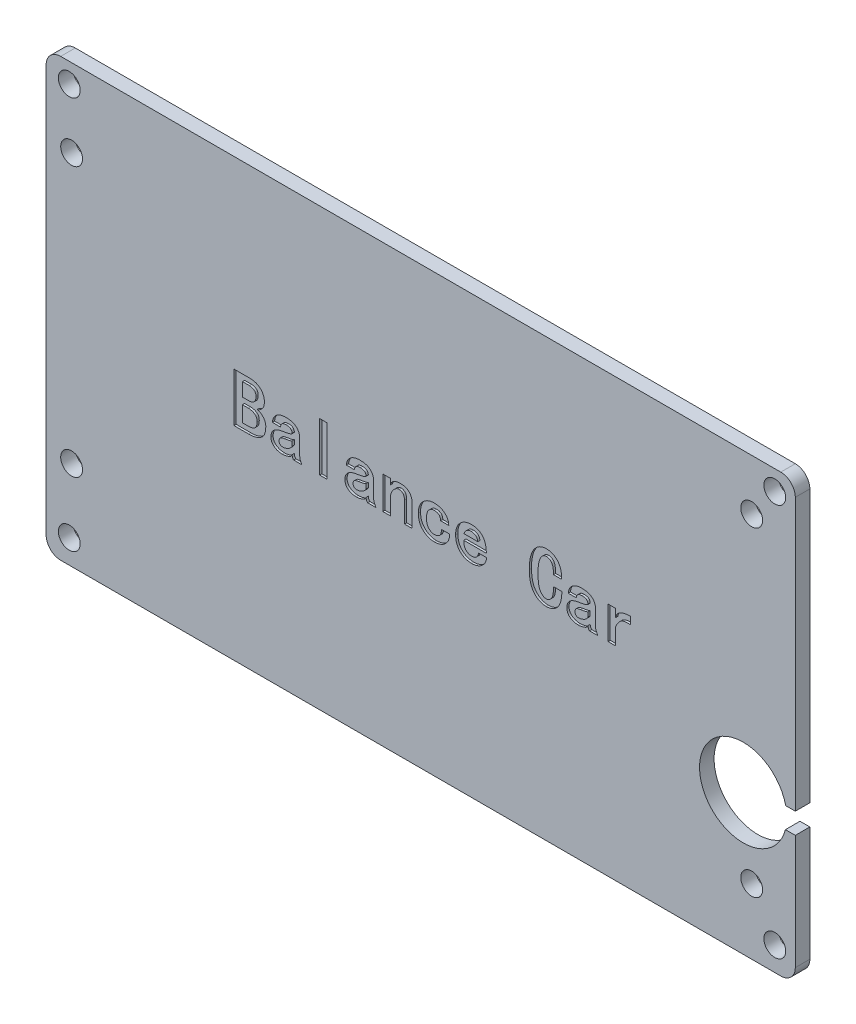
from build123d import *

# Parameters (mm, degrees)
SKETCH_1_R          = 1.5
EXTRUDE_1_DEPTH     = 2
SKETCH_2_W          = 1.042999115
SKETCH_2_H          = 6.730377939
CUT_EXTRUDE_1_DEPTH = 0.3


with BuildPart() as part:
    # 草图1 → 凸台-拉伸1 (new body)
    with BuildSketch(Plane.XY):
        with BuildLine():
            Line((26.817070392, -30.978962474), (26.817070392, -46.730080149))
            ThreePointArc((26.817070392, -46.730080149), (26.231283954, -48.144293711), (24.817070392, -48.730080149))
            Line((24.817070392, -48.730080149), (-74.182929608, -48.730080149))
            ThreePointArc((-74.182929608, -48.730080149), (-75.59714317, -48.144293711), (-76.182929608, -46.730080149))
            Line((-76.182929608, -46.730080149), (-76.182929608, 9.269919851))
            ThreePointArc((-76.182929608, 9.269919851), (-75.59714317, 10.684133414), (-74.182929608, 11.269919851))
            Line((-74.182929608, 11.269919851), (24.817070392, 11.269919851))
            ThreePointArc((24.817070392, 11.269919851), (26.231283954, 10.684133414), (26.817070392, 9.269919851))
            Line((26.817070392, 9.269919851), (26.817070392, -28.10613796))
            Line((26.817070392, -28.10613796), (25.497876265, -28.10613796))
            ThreePointArc((25.497876265, -28.10613796), (13.653701765, -29.379481549), (25.458257421, -30.978962474))
            Line((25.458257421, -30.978962474), (26.817070392, -30.978962474))
        make_face()
        with Locations((-73.004739745, 8.560498058)):
            Circle(SKETCH_1_R, mode=Mode.SUBTRACT)
        with Locations((23.995260255, 8.560498058)):
            Circle(SKETCH_1_R, mode=Mode.SUBTRACT)
        with Locations((20.817070392, 4.269919851)):
            Circle(SKETCH_1_R, mode=Mode.SUBTRACT)
        with Locations((-72.682929608, 0.547627493)):
            Circle(SKETCH_1_R, mode=Mode.SUBTRACT)
        with Locations((-73.004739745, -45.439501942)):
            Circle(SKETCH_1_R, mode=Mode.SUBTRACT)
        with Locations((-72.682929608, -36.452372507)):
            Circle(SKETCH_1_R, mode=Mode.SUBTRACT)
        with Locations((23.995260255, -45.439501942)):
            Circle(SKETCH_1_R, mode=Mode.SUBTRACT)
        with Locations((20.817070392, -39.730080149)):
            Circle(SKETCH_1_R, mode=Mode.SUBTRACT)
    extrude(amount=EXTRUDE_1_DEPTH)

    # 草图2 → 切除-拉伸1 (cut)
    # profile 1 of 10: a face of its own
    with BuildSketch(Plane.XY.offset(2)):
        with BuildLine():
            add(Edge.make_bspline(
                [(-45.985135768, -18.734413433), (-45.986803011, -18.825043737), (-45.990024548, -19.000164548), (-46.022328184, -19.252162776), (-46.073830874, -19.483628418), (-46.145240111, -19.69479899), (-46.239624747, -19.884323675), (-46.354934414, -20.052492992), (-46.490547453, -20.200648991), (-46.647923039, -20.325821392), (-46.821047256, -20.431966568), (-47.005499215, -20.524413636), (-47.200614613, -20.604794987), (-47.408572708, -20.667138425), (-47.627314907, -20.719020233), (-47.858495469, -20.751771594), (-48.101005177, -20.774827928), (-48.266577138, -20.777268331), (-48.351385836, -20.778518345)],
                knots=[0, 0, 0, 0, 1.214216004, 2.346174309, 3.398354795, 4.388279313, 5.326350126, 6.226833345, 7.112954168, 8.008031957, 8.912461697, 9.830332446, 10.771174523, 11.736815783, 12.73722573, 13.781438273, 14.863615984, 16, 16, 16, 16], degree=3))
            Line((-48.351385836, -20.778518345), (-50.357931223, -20.778518345))
            Line((-50.357931223, -20.778518345), (-50.357931223, -14.048140406))
            Line((-50.357931223, -14.048140406), (-48.274822189, -14.048140406))
            add(Edge.make_bspline(
                [(-48.274822189, -14.048140406), (-48.189066218, -14.049898241), (-48.022962927, -14.053303045), (-47.782022008, -14.076781247), (-47.558849711, -14.121487965), (-47.35072031, -14.177188451), (-47.160877903, -14.254775413), (-46.987113777, -14.346959927), (-46.830941346, -14.457871842), (-46.693200204, -14.584967527), (-46.572725138, -14.722511592), (-46.466118874, -14.864516212), (-46.37606078, -15.011832411), (-46.303696086, -15.165254492), (-46.245162957, -15.322475818), (-46.204464797, -15.485719642), (-46.181490121, -15.653874178), (-46.177722677, -15.767625144), (-46.175822587, -15.824994852)],
                knots=[0, 0, 0, 0, 1.33113717, 2.578319164, 3.750959862, 4.860775065, 5.916972853, 6.926855544, 7.90778062, 8.88113087, 9.828922234, 10.742256505, 11.634396839, 12.503607127, 13.37140239, 14.234259165, 15.109457783, 16, 16, 16, 16], degree=3))
            add(Edge.make_bspline(
                [(-46.175822587, -15.824994852), (-46.176991183, -15.881373114), (-46.179263294, -15.990989843), (-46.195125336, -16.150401212), (-46.221588754, -16.299082172), (-46.261831192, -16.436423274), (-46.309296702, -16.563757837), (-46.371416989, -16.678803847), (-46.441996323, -16.784337559), (-46.549659578, -16.904446269), (-46.688602589, -17.029386027), (-46.853331069, -17.148780115), (-47.012274899, -17.232268379), (-47.120381871, -17.256682329), (-47.171149996, -17.268147366)],
                knots=[0, 0, 0, 0, 1.066354622, 2.073322247, 3.027359755, 3.918209834, 4.777534225, 5.592506442, 6.385810961, 7.17328942, 8.6370913, 9.910926524, 11.018950027, 12, 12, 12, 12], degree=3))
            add(Edge.make_bspline(
                [(-47.171149996, -17.268147366), (-47.10390849, -17.281959962), (-46.964896089, -17.310515571), (-46.763382797, -17.406475449), (-46.564535826, -17.543294002), (-46.406242733, -17.687133627), (-46.283487497, -17.817590845), (-46.205010737, -17.928439742), (-46.135303836, -18.044483702), (-46.081544383, -18.169326697), (-46.037089594, -18.299988058), (-46.007517039, -18.438665562), (-45.98792576, -18.584092611), (-45.986075432, -18.683785651), (-45.985135768, -18.734413433)],
                knots=[0, 0, 0, 0, 1.203910315, 2.488916061, 3.891524143, 5.439134463, 6.242555454, 7.037221142, 7.823170937, 8.619595385, 9.423194974, 10.247336316, 11.109933089, 12, 12, 12, 12], degree=3))
        make_face()
        with BuildLine():
            add(Edge.make_bspline(
                [(-47.33438947, -15.824994852), (-47.335286994, -15.788368864), (-47.337015919, -15.717815243), (-47.348383372, -15.615721236), (-47.368373382, -15.521220794), (-47.397304958, -15.434642871), (-47.433364792, -15.355156757), (-47.478806726, -15.284349056), (-47.530482586, -15.219545151), (-47.613039841, -15.147057976), (-47.727579641, -15.07040969), (-47.883781783, -15.006249414), (-48.05518492, -14.966526395), (-48.175402382, -14.96200682), (-48.237262664, -14.959681183)],
                knots=[0, 0, 0, 0, 0.927142937, 1.785980239, 2.596484439, 3.367432301, 4.092799605, 4.799595254, 5.492591191, 6.183009329, 7.572534581, 8.960294269, 10.435859072, 12, 12, 12, 12], degree=3))
            Line((-48.237262664, -14.959681183), (-49.200808937, -14.959681183))
            Line((-49.200808937, -14.959681183), (-49.200808937, -16.804431693))
            Line((-49.200808937, -16.804431693), (-48.274822189, -16.804431693))
            add(Edge.make_bspline(
                [(-48.274822189, -16.804431693), (-48.21245414, -16.801704139), (-48.090577703, -16.796374091), (-47.915079775, -16.753243311), (-47.753201525, -16.683421245), (-47.632001157, -16.600945914), (-47.544622873, -16.521153919), (-47.487974613, -16.449298283), (-47.440440032, -16.367899184), (-47.401415436, -16.277630618), (-47.370740919, -16.177886115), (-47.349891002, -16.068402212), (-47.336642409, -15.949554228), (-47.335156592, -15.867407145), (-47.33438947, -15.824994852)],
                knots=[0, 0, 0, 0, 1.451379929, 2.836212108, 4.182481497, 5.538993073, 6.229475639, 6.931972211, 7.661100203, 8.419662085, 9.217987839, 10.086952726, 11.012299424, 12, 12, 12, 12], degree=3))
        make_face(mode=Mode.SUBTRACT)
        with BuildLine():
            add(Edge.make_bspline(
                [(-47.181262176, -18.734413433), (-47.182320078, -18.689575769), (-47.184376077, -18.602435184), (-47.201627928, -18.476947839), (-47.230458719, -18.361554248), (-47.270444692, -18.256740645), (-47.323680086, -18.162829563), (-47.38690171, -18.078365926), (-47.463340959, -18.005126301), (-47.580208899, -17.923574465), (-47.739508623, -17.83929851), (-47.945486894, -17.769143092), (-48.163523583, -17.723538539), (-48.31359096, -17.718533742), (-48.390389958, -17.71597247)],
                knots=[0, 0, 0, 0, 0.89950437, 1.748158365, 2.535631478, 3.282137647, 3.991705508, 4.695193889, 5.392281939, 6.105590437, 7.549383668, 8.991818094, 10.460522455, 12, 12, 12, 12], degree=3))
            Line((-48.390389958, -17.71597247), (-49.200808937, -17.71597247))
            Line((-49.200808937, -17.71597247), (-49.200808937, -19.866977568))
            Line((-49.200808937, -19.866977568), (-48.50451313, -19.866977568))
            add(Edge.make_bspline(
                [(-48.50451313, -19.866977568), (-48.451040077, -19.866108264), (-48.347816611, -19.864430175), (-48.197837714, -19.852618269), (-48.058385593, -19.834277866), (-47.928722602, -19.808815908), (-47.809994391, -19.773929932), (-47.701119263, -19.732192517), (-47.60190371, -19.683204505), (-47.512580489, -19.625175054), (-47.433514816, -19.556463416), (-47.364295169, -19.47630615), (-47.308364404, -19.381721815), (-47.260242184, -19.276455969), (-47.224748, -19.157744454), (-47.198682102, -19.027699024), (-47.18505884, -18.884935998), (-47.182562403, -18.785962237), (-47.181262176, -18.734413433)],
                knots=[0, 0, 0, 0, 1.269965571, 2.451519813, 3.57082322, 4.609321398, 5.586495255, 6.506157291, 7.375666785, 8.209937576, 9.028698946, 9.856121335, 10.713282766, 11.629524913, 12.599038758, 13.648749371, 14.775391023, 16, 16, 16, 16], degree=3))
        make_face(mode=Mode.SUBTRACT)
    # profile 2 of 10: a face of its own
    with BuildSketch(Plane.XY.offset(2)):
        with BuildLine():
            Line((-41.014277109, -20.778518345), (-42.158398021, -20.778518345))
            add(Edge.make_bspline(
                [(-42.158398021, -20.778518345), (-42.194184962, -20.737819291), (-42.264220465, -20.658170717), (-42.323646686, -20.513435035), (-42.354240787, -20.374412659), (-42.360604058, -20.284107973), (-42.363530811, -20.242572817)],
                knots=[0, 0, 0, 0, 1.100022695, 2.152758582, 3.150371228, 4, 4, 4, 4], degree=3))
            add(Edge.make_bspline(
                [(-42.363530811, -20.242572817), (-42.367619879, -20.26443148), (-42.375925903, -20.308832449), (-42.40228947, -20.372932443), (-42.44259536, -20.433167615), (-42.495467346, -20.489322513), (-42.5598347, -20.543305047), (-42.637159455, -20.593668203), (-42.726889492, -20.640843598), (-42.861692789, -20.699990857), (-43.041304621, -20.761914403), (-43.264925353, -20.814834616), (-43.493531362, -20.850108527), (-43.648128885, -20.853419056), (-43.725785887, -20.855081992)],
                knots=[0, 0, 0, 0, 0.502173328, 1.020052439, 1.554841723, 2.133027758, 2.759295304, 3.451193378, 4.216313692, 5.050302141, 6.779755723, 8.50512169, 10.244462344, 12, 12, 12, 12], degree=3))
            add(Edge.make_bspline(
                [(-43.725785887, -20.855081992), (-43.778297357, -20.853735711), (-43.881587982, -20.851087563), (-44.033850083, -20.837224245), (-44.180079794, -20.810833718), (-44.320640788, -20.77477687), (-44.45515428, -20.728869249), (-44.583352528, -20.671615602), (-44.706006111, -20.605692528), (-44.821551339, -20.529432082), (-44.927570174, -20.443206233), (-45.0196658, -20.34622735), (-45.099930276, -20.241018272), (-45.162523738, -20.125030615), (-45.212891961, -20.000669446), (-45.246450285, -19.866918219), (-45.269205424, -19.72473526), (-45.271681189, -19.626787186), (-45.272949392, -19.576613549)],
                knots=[0, 0, 0, 0, 1.116649071, 2.19646067, 3.246750187, 4.27224868, 5.279130669, 6.264549121, 7.25400097, 8.236436849, 9.20382194, 10.152389194, 11.073772815, 12.008482691, 12.945712081, 13.919091576, 14.934060268, 16, 16, 16, 16], degree=3))
            add(Edge.make_bspline(
                [(-45.272949392, -19.576613549), (-45.272186765, -19.526448252), (-45.270698749, -19.428567166), (-45.248968172, -19.286066003), (-45.217894354, -19.150848775), (-45.173268378, -19.023175052), (-45.114493981, -18.904115777), (-45.045172759, -18.791279797), (-44.960869178, -18.687763381), (-44.864523766, -18.591460958), (-44.755235592, -18.502725748), (-44.632530332, -18.422443076), (-44.496623949, -18.349677676), (-44.348241227, -18.285194112), (-44.186369649, -18.228703588), (-44.011568661, -18.180258243), (-43.823690524, -18.137686834), (-43.693190519, -18.117721307), (-43.626108686, -18.107458287)],
                knots=[0, 0, 0, 0, 0.983259561, 1.918507781, 2.821368131, 3.702819264, 4.564764925, 5.421986139, 6.29545235, 7.177257814, 8.090585748, 9.052230552, 10.049773976, 11.111675609, 12.223185354, 13.41059661, 14.668950802, 16, 16, 16, 16], degree=3))
            add(Edge.make_bspline(
                [(-43.626108686, -18.107458287), (-43.540315295, -18.094457502), (-43.375609097, -18.069498587), (-43.140088976, -18.025950423), (-42.92578067, -17.98075615), (-42.762582533, -17.937372519), (-42.645297363, -17.903038726), (-42.571437187, -17.874952302), (-42.508166217, -17.848612769), (-42.456326309, -17.820728615), (-42.415558955, -17.79294246), (-42.386759483, -17.762954712), (-42.367395347, -17.732440872), (-42.364764931, -17.710415578), (-42.363530811, -17.700081902)],
                knots=[0, 0, 0, 0, 2.284980094, 4.386705999, 6.306867416, 8.050866871, 8.833092395, 9.523248254, 10.131012504, 10.63602979, 11.072375292, 11.422197182, 11.728910465, 12, 12, 12, 12], degree=3))
            add(Edge.make_bspline(
                [(-42.363530811, -17.700081902), (-42.365058019, -17.667126203), (-42.368192435, -17.599488474), (-42.399451608, -17.49967558), (-42.446721993, -17.39935173), (-42.500836718, -17.317696016), (-42.556231397, -17.253809308), (-42.613414931, -17.213154721), (-42.68117586, -17.178964681), (-42.760986625, -17.151549915), (-42.851578558, -17.130599778), (-42.953932687, -17.114849828), (-43.067802558, -17.104531212), (-43.147922602, -17.103830105), (-43.189840358, -17.103463295)],
                knots=[0, 0, 0, 0, 1.02146559, 2.096438976, 3.22098731, 4.461868767, 5.12921033, 5.83550898, 6.625174876, 7.481756993, 8.450804338, 9.511097336, 10.697838769, 12, 12, 12, 12], degree=3))
            add(Edge.make_bspline(
                [(-43.189840358, -17.103463295), (-43.247216103, -17.105054189), (-43.353911247, -17.108012592), (-43.502489912, -17.131052777), (-43.625539609, -17.173923854), (-43.728731409, -17.23516751), (-43.808924117, -17.326099957), (-43.880457251, -17.440787465), (-43.939720108, -17.587356128), (-43.969692109, -17.696350827), (-43.985813367, -17.754976592)],
                knots=[0, 0, 0, 0, 1.199713594, 2.230970886, 3.129074979, 3.911404785, 4.709324343, 5.636805749, 6.728891641, 8, 8, 8, 8], degree=3))
            Line((-43.985813367, -17.754976592), (-45.082262574, -17.754976592))
            add(Edge.make_bspline(
                [(-45.082262574, -17.754976592), (-45.073972562, -17.694165316), (-45.057743847, -17.575119779), (-45.019492474, -17.403016425), (-44.965558333, -17.242345267), (-44.897741728, -17.093993829), (-44.817592071, -16.956061395), (-44.723891013, -16.830197771), (-44.61539977, -16.716734489), (-44.495435581, -16.61402959), (-44.364080175, -16.52332925), (-44.222677606, -16.444766762), (-44.072099226, -16.378658038), (-43.912867247, -16.323280613), (-43.744428229, -16.281874994), (-43.567733116, -16.251819667), (-43.381931909, -16.232179284), (-43.254898631, -16.230395554), (-43.189840358, -16.229482043)],
                knots=[0, 0, 0, 0, 1.089185795, 2.132214889, 3.124226488, 4.091967635, 5.022881988, 5.95116336, 6.870189767, 7.803807937, 8.749864533, 9.698812801, 10.670847843, 11.665617538, 12.687666101, 13.745821166, 14.845554606, 16, 16, 16, 16], degree=3))
            add(Edge.make_bspline(
                [(-43.189840358, -16.229482043), (-43.114211544, -16.231094504), (-42.967051088, -16.234232072), (-42.753946583, -16.251894085), (-42.555567929, -16.285677887), (-42.372167556, -16.331073833), (-42.2025646, -16.390466258), (-42.048555299, -16.463627509), (-41.908655704, -16.549924111), (-41.784780831, -16.649299918), (-41.676172183, -16.760479821), (-41.579646615, -16.878446209), (-41.500410973, -17.00741627), (-41.432469515, -17.14355385), (-41.382901778, -17.290113085), (-41.346371131, -17.444837548), (-41.324551874, -17.607968122), (-41.321887501, -17.719759123), (-41.320531697, -17.776645549)],
                knots=[0, 0, 0, 0, 1.318220954, 2.565027611, 3.722553634, 4.82165684, 5.854152741, 6.848885895, 7.787371559, 8.712669592, 9.608735395, 10.492096577, 11.36297217, 12.241216083, 13.13826379, 14.052227777, 15.008848671, 16, 16, 16, 16], degree=3))
            Line((-41.320531697, -17.776645549), (-41.320531697, -19.882868137))
            add(Edge.make_bspline(
                [(-41.320531697, -19.882868137), (-41.319849361, -19.920478842), (-41.318505617, -19.994546775), (-41.303522722, -20.102339186), (-41.280636911, -20.204443179), (-41.247527507, -20.302887532), (-41.203053325, -20.404298757), (-41.149286811, -20.516637974), (-41.086069757, -20.643493298), (-41.039052227, -20.731922189), (-41.014277109, -20.778518345)],
                knots=[0, 0, 0, 0, 0.941403301, 1.853934819, 2.719932207, 3.558972484, 4.450542, 5.491721692, 6.67830383, 8, 8, 8, 8], degree=3))
        make_face()
        with BuildLine():
            Line((-42.363530811, -19.247245408), (-42.363530811, -18.597176708))
            add(Edge.make_bspline(
                [(-42.363530811, -18.597176708), (-42.374684716, -18.607844799), (-42.401330925, -18.633330418), (-42.461776174, -18.662103718), (-42.542909475, -18.692867852), (-42.649981547, -18.725403266), (-42.786378546, -18.756089616), (-42.956818427, -18.791111388), (-43.163461006, -18.828153951), (-43.314023915, -18.851744082), (-43.394973148, -18.864427173)],
                knots=[0, 0, 0, 0, 0.342881926, 0.819130423, 1.476051372, 2.285518165, 3.313039493, 4.597202055, 6.17050637, 8, 8, 8, 8], degree=3))
            add(Edge.make_bspline(
                [(-43.394973148, -18.864427173), (-43.43305484, -18.8699269), (-43.50609295, -18.880475004), (-43.610505703, -18.900070633), (-43.703723678, -18.925036189), (-43.787020391, -18.950546285), (-43.859553131, -18.97939458), (-43.921970419, -19.010533279), (-43.973594835, -19.045449116), (-44.02752141, -19.095519391), (-44.078821113, -19.168382895), (-44.122937557, -19.26744676), (-44.148842573, -19.379808493), (-44.151834697, -19.458983788), (-44.153386631, -19.500049902)],
                knots=[0, 0, 0, 0, 1.241544523, 2.381198435, 3.425107394, 4.353856387, 5.190577729, 5.941057891, 6.600442346, 7.194130352, 8.306773393, 9.447380148, 10.676024142, 12, 12, 12, 12], degree=3))
            add(Edge.make_bspline(
                [(-44.153386631, -19.500049902), (-44.151743158, -19.534873618), (-44.148571386, -19.6020806), (-44.123696059, -19.697402435), (-44.082738757, -19.781647523), (-44.025745089, -19.853996426), (-43.951822919, -19.911255742), (-43.862863177, -19.951845175), (-43.760310395, -19.976428736), (-43.687407187, -19.979494806), (-43.64922224, -19.98110074)],
                knots=[0, 0, 0, 0, 1.05772411, 2.041322773, 2.971040824, 3.887875324, 4.816209179, 5.7855409, 6.840119581, 8, 8, 8, 8], degree=3))
            add(Edge.make_bspline(
                [(-43.64922224, -19.98110074), (-43.59369922, -19.978645615), (-43.479799731, -19.97360919), (-43.306163928, -19.938470628), (-43.127058656, -19.881086826), (-42.943864388, -19.804637924), (-42.765871267, -19.705532195), (-42.608700779, -19.575266503), (-42.469278719, -19.424813643), (-42.399091036, -19.30695691), (-42.363530811, -19.247245408)],
                knots=[0, 0, 0, 0, 0.860490765, 1.765204036, 2.735501431, 3.772501338, 4.839087704, 5.878985014, 6.925398771, 8, 8, 8, 8], degree=3))
        make_face(mode=Mode.SUBTRACT)
    # profile 3 of 10: a face of its own
    with BuildSketch(Plane.XY.offset(2)):
        with Locations((-38.05863142, -17.413329376)):
            Rectangle(SKETCH_2_W, SKETCH_2_H)
    # profile 4 of 10: a face of its own
    with BuildSketch(Plane.XY.offset(2)):
        with BuildLine():
            Line((-30.844313449, -20.778518345), (-31.98843436, -20.778518345))
            add(Edge.make_bspline(
                [(-31.98843436, -20.778518345), (-32.024221301, -20.737819291), (-32.094256804, -20.658170717), (-32.153683025, -20.513435035), (-32.184277126, -20.374412659), (-32.190640398, -20.284107973), (-32.19356715, -20.242572817)],
                knots=[0, 0, 0, 0, 1.100022695, 2.152758582, 3.150371228, 4, 4, 4, 4], degree=3))
            add(Edge.make_bspline(
                [(-32.19356715, -20.242572817), (-32.197656218, -20.26443148), (-32.205962242, -20.308832449), (-32.232325809, -20.372932443), (-32.272631699, -20.433167615), (-32.325503685, -20.489322513), (-32.389871039, -20.543305047), (-32.467195794, -20.593668203), (-32.556925831, -20.640843598), (-32.691729128, -20.699990857), (-32.87134096, -20.761914403), (-33.094961692, -20.814834616), (-33.323567701, -20.850108527), (-33.478165224, -20.853419056), (-33.555822226, -20.855081992)],
                knots=[0, 0, 0, 0, 0.502173328, 1.020052439, 1.554841723, 2.133027758, 2.759295304, 3.451193378, 4.216313692, 5.050302141, 6.779755723, 8.50512169, 10.244462344, 12, 12, 12, 12], degree=3))
            add(Edge.make_bspline(
                [(-33.555822226, -20.855081992), (-33.608333696, -20.853735711), (-33.711624321, -20.851087563), (-33.863886422, -20.837224245), (-34.010116133, -20.810833718), (-34.150677127, -20.77477687), (-34.285190619, -20.728869249), (-34.413388868, -20.671615602), (-34.53604245, -20.605692528), (-34.651587678, -20.529432082), (-34.757606513, -20.443206233), (-34.849702139, -20.34622735), (-34.929966615, -20.241018272), (-34.992560077, -20.125030615), (-35.0429283, -20.000669446), (-35.076486624, -19.866918219), (-35.099241764, -19.72473526), (-35.101717528, -19.626787186), (-35.102985732, -19.576613549)],
                knots=[0, 0, 0, 0, 1.116649071, 2.19646067, 3.246750187, 4.27224868, 5.279130669, 6.264549121, 7.25400097, 8.236436849, 9.20382194, 10.152389194, 11.073772815, 12.008482691, 12.945712081, 13.919091576, 14.934060268, 16, 16, 16, 16], degree=3))
            add(Edge.make_bspline(
                [(-35.102985732, -19.576613549), (-35.102223105, -19.526448252), (-35.100735089, -19.428567166), (-35.079004511, -19.286066003), (-35.047930694, -19.150848775), (-35.003304718, -19.023175052), (-34.94453032, -18.904115777), (-34.875209098, -18.791279797), (-34.790905517, -18.687763381), (-34.694560106, -18.591460958), (-34.585271931, -18.502725748), (-34.462566671, -18.422443076), (-34.326660289, -18.349677676), (-34.178277566, -18.285194112), (-34.016405988, -18.228703588), (-33.841605, -18.180258243), (-33.653726863, -18.137686834), (-33.523226858, -18.117721307), (-33.456145025, -18.107458287)],
                knots=[0, 0, 0, 0, 0.983259561, 1.918507781, 2.821368131, 3.702819264, 4.564764925, 5.421986139, 6.29545235, 7.177257814, 8.090585748, 9.052230552, 10.049773976, 11.111675609, 12.223185354, 13.41059661, 14.668950802, 16, 16, 16, 16], degree=3))
            add(Edge.make_bspline(
                [(-33.456145025, -18.107458287), (-33.370351634, -18.094457502), (-33.205645437, -18.069498587), (-32.970125315, -18.025950423), (-32.755817009, -17.98075615), (-32.592618872, -17.937372519), (-32.475333702, -17.903038726), (-32.401473526, -17.874952302), (-32.338202556, -17.848612769), (-32.286362648, -17.820728615), (-32.245595294, -17.79294246), (-32.216795822, -17.762954712), (-32.197431686, -17.732440872), (-32.19480127, -17.710415578), (-32.19356715, -17.700081902)],
                knots=[0, 0, 0, 0, 2.284980094, 4.386705999, 6.306867416, 8.050866871, 8.833092395, 9.523248254, 10.131012504, 10.63602979, 11.072375292, 11.422197182, 11.728910465, 12, 12, 12, 12], degree=3))
            add(Edge.make_bspline(
                [(-32.19356715, -17.700081902), (-32.195094358, -17.667126203), (-32.198228774, -17.599488474), (-32.229487947, -17.49967558), (-32.276758332, -17.39935173), (-32.330873057, -17.317696016), (-32.386267736, -17.253809308), (-32.44345127, -17.213154721), (-32.511212199, -17.178964681), (-32.591022965, -17.151549915), (-32.681614897, -17.130599778), (-32.783969027, -17.114849828), (-32.897838898, -17.104531212), (-32.977958941, -17.103830105), (-33.019876698, -17.103463295)],
                knots=[0, 0, 0, 0, 1.02146559, 2.096438976, 3.22098731, 4.461868767, 5.12921033, 5.83550898, 6.625174876, 7.481756993, 8.450804338, 9.511097336, 10.697838769, 12, 12, 12, 12], degree=3))
            add(Edge.make_bspline(
                [(-33.019876698, -17.103463295), (-33.077252442, -17.105054189), (-33.183947587, -17.108012592), (-33.332526251, -17.131052777), (-33.455575948, -17.173923854), (-33.558767748, -17.23516751), (-33.638960456, -17.326099957), (-33.71049359, -17.440787465), (-33.769756447, -17.587356128), (-33.799728449, -17.696350827), (-33.815849706, -17.754976592)],
                knots=[0, 0, 0, 0, 1.199713594, 2.230970886, 3.129074979, 3.911404785, 4.709324343, 5.636805749, 6.728891641, 8, 8, 8, 8], degree=3))
            Line((-33.815849706, -17.754976592), (-34.912298913, -17.754976592))
            add(Edge.make_bspline(
                [(-34.912298913, -17.754976592), (-34.904008901, -17.694165316), (-34.887780187, -17.575119779), (-34.849528813, -17.403016425), (-34.795594672, -17.242345267), (-34.727778067, -17.093993829), (-34.64762841, -16.956061395), (-34.553927352, -16.830197771), (-34.445436109, -16.716734489), (-34.32547192, -16.61402959), (-34.194116514, -16.52332925), (-34.052713945, -16.444766762), (-33.902135565, -16.378658038), (-33.742903586, -16.323280613), (-33.574464568, -16.281874994), (-33.397769455, -16.251819667), (-33.211968248, -16.232179284), (-33.084934971, -16.230395554), (-33.019876698, -16.229482043)],
                knots=[0, 0, 0, 0, 1.089185795, 2.132214889, 3.124226488, 4.091967635, 5.022881988, 5.95116336, 6.870189767, 7.803807937, 8.749864533, 9.698812801, 10.670847843, 11.665617538, 12.687666101, 13.745821166, 14.845554606, 16, 16, 16, 16], degree=3))
            add(Edge.make_bspline(
                [(-33.019876698, -16.229482043), (-32.944247883, -16.231094504), (-32.797087427, -16.234232072), (-32.583982922, -16.251894085), (-32.385604268, -16.285677887), (-32.202203895, -16.331073833), (-32.032600939, -16.390466258), (-31.878591638, -16.463627509), (-31.738692043, -16.549924111), (-31.61481717, -16.649299918), (-31.506208522, -16.760479821), (-31.409682954, -16.878446209), (-31.330447313, -17.00741627), (-31.262505854, -17.14355385), (-31.212938117, -17.290113085), (-31.17640747, -17.444837548), (-31.154588213, -17.607968122), (-31.15192384, -17.719759123), (-31.150568036, -17.776645549)],
                knots=[0, 0, 0, 0, 1.318220954, 2.565027611, 3.722553634, 4.82165684, 5.854152741, 6.848885895, 7.787371559, 8.712669592, 9.608735395, 10.492096577, 11.36297217, 12.241216083, 13.13826379, 14.052227777, 15.008848671, 16, 16, 16, 16], degree=3))
            Line((-31.150568036, -17.776645549), (-31.150568036, -19.882868137))
            add(Edge.make_bspline(
                [(-31.150568036, -19.882868137), (-31.1498857, -19.920478842), (-31.148541956, -19.994546775), (-31.133559061, -20.102339186), (-31.11067325, -20.204443179), (-31.077563846, -20.302887532), (-31.033089664, -20.404298757), (-30.97932315, -20.516637974), (-30.916106096, -20.643493298), (-30.869088566, -20.731922189), (-30.844313449, -20.778518345)],
                knots=[0, 0, 0, 0, 0.941403301, 1.853934819, 2.719932207, 3.558972484, 4.450542, 5.491721692, 6.67830383, 8, 8, 8, 8], degree=3))
        make_face()
        with BuildLine():
            Line((-32.19356715, -19.247245408), (-32.19356715, -18.597176708))
            add(Edge.make_bspline(
                [(-32.19356715, -18.597176708), (-32.204721056, -18.607844799), (-32.231367264, -18.633330418), (-32.291812514, -18.662103718), (-32.372945814, -18.692867852), (-32.480017886, -18.725403266), (-32.616414886, -18.756089616), (-32.786854767, -18.791111388), (-32.993497345, -18.828153951), (-33.144060254, -18.851744082), (-33.225009487, -18.864427173)],
                knots=[0, 0, 0, 0, 0.342881926, 0.819130423, 1.476051372, 2.285518165, 3.313039493, 4.597202055, 6.17050637, 8, 8, 8, 8], degree=3))
            add(Edge.make_bspline(
                [(-33.225009487, -18.864427173), (-33.263091179, -18.8699269), (-33.336129289, -18.880475004), (-33.440542042, -18.900070633), (-33.533760017, -18.925036189), (-33.61705673, -18.950546285), (-33.68958947, -18.97939458), (-33.752006759, -19.010533279), (-33.803631174, -19.045449116), (-33.857557749, -19.095519391), (-33.908857452, -19.168382895), (-33.952973896, -19.26744676), (-33.978878912, -19.379808493), (-33.981871036, -19.458983788), (-33.983422971, -19.500049902)],
                knots=[0, 0, 0, 0, 1.241544523, 2.381198435, 3.425107394, 4.353856387, 5.190577729, 5.941057891, 6.600442346, 7.194130352, 8.306773393, 9.447380148, 10.676024142, 12, 12, 12, 12], degree=3))
            add(Edge.make_bspline(
                [(-33.983422971, -19.500049902), (-33.981779497, -19.534873618), (-33.978607725, -19.6020806), (-33.953732398, -19.697402435), (-33.912775097, -19.781647523), (-33.855781428, -19.853996426), (-33.781859258, -19.911255742), (-33.692899516, -19.951845175), (-33.590346735, -19.976428736), (-33.517443526, -19.979494806), (-33.479258579, -19.98110074)],
                knots=[0, 0, 0, 0, 1.05772411, 2.041322773, 2.971040824, 3.887875324, 4.816209179, 5.7855409, 6.840119581, 8, 8, 8, 8], degree=3))
            add(Edge.make_bspline(
                [(-33.479258579, -19.98110074), (-33.423735559, -19.978645615), (-33.30983607, -19.97360919), (-33.136200267, -19.938470628), (-32.957094996, -19.881086826), (-32.773900727, -19.804637924), (-32.595907606, -19.705532195), (-32.438737118, -19.575266503), (-32.299315059, -19.424813643), (-32.229127375, -19.30695691), (-32.19356715, -19.247245408)],
                knots=[0, 0, 0, 0, 0.860490765, 1.765204036, 2.735501431, 3.772501338, 4.839087704, 5.878985014, 6.925398771, 8, 8, 8, 8], degree=3))
        make_face(mode=Mode.SUBTRACT)
    # profile 5 of 10: a face of its own
    with BuildSketch(Plane.XY.offset(2)):
        with BuildLine():
            Line((-25.874899387, -20.778518345), (-26.917898501, -20.778518345))
            Line((-26.917898501, -20.778518345), (-26.917898501, -17.929772843))
            add(Edge.make_bspline(
                [(-26.917898501, -17.929772843), (-26.920320895, -17.862680438), (-26.924929635, -17.735033404), (-26.961316536, -17.554402101), (-27.027711935, -17.397821618), (-27.117419257, -17.264566187), (-27.22932666, -17.157803428), (-27.360019766, -17.080354551), (-27.508572684, -17.033971495), (-27.613373552, -17.029312366), (-27.667644402, -17.026899648)],
                knots=[0, 0, 0, 0, 1.216863201, 2.315149986, 3.321170057, 4.283135302, 5.21006998, 6.103036323, 7.017662436, 8, 8, 8, 8], degree=3))
            add(Edge.make_bspline(
                [(-27.667644402, -17.026899648), (-27.700065837, -17.028150061), (-27.765727927, -17.030682481), (-27.86335764, -17.056385455), (-27.96251463, -17.091679772), (-28.061536661, -17.145226464), (-28.160323176, -17.21359353), (-28.261227285, -17.294766793), (-28.360110162, -17.392955534), (-28.460569366, -17.501699832), (-28.553715214, -17.623803168), (-28.637025406, -17.755738225), (-28.705833703, -17.897506539), (-28.762586379, -18.047951123), (-28.807423061, -18.206898597), (-28.838836264, -18.375133677), (-28.858067568, -18.551942057), (-28.859930298, -18.672727126), (-28.860881615, -18.734413433)],
                knots=[0, 0, 0, 0, 0.682613816, 1.382475802, 2.118568624, 2.900295691, 3.748519943, 4.65139024, 5.628549074, 6.685825316, 7.772994265, 8.863954573, 9.97265371, 11.091639823, 12.252774275, 13.452344516, 14.698883392, 16, 16, 16, 16], degree=3))
            Line((-28.860881615, -18.734413433), (-28.860881615, -20.778518345))
            Line((-28.860881615, -20.778518345), (-29.903880729, -20.778518345))
            Line((-29.903880729, -20.778518345), (-29.903880729, -16.30604569))
            Line((-29.903880729, -16.30604569), (-28.860881615, -16.30604569))
            Line((-28.860881615, -16.30604569), (-28.860881615, -17.110686281))
            add(Edge.make_bspline(
                [(-28.860881615, -17.110686281), (-28.854736576, -17.078294284), (-28.842571723, -17.014170387), (-28.813895863, -16.920556481), (-28.77270653, -16.83302851), (-28.724033668, -16.748958179), (-28.661393259, -16.672973889), (-28.592835763, -16.597943263), (-28.511212115, -16.531009375), (-28.389287358, -16.446233085), (-28.214739682, -16.357308639), (-27.979373974, -16.283661173), (-27.717718868, -16.235817527), (-27.534006742, -16.231657237), (-27.437953461, -16.229482043)],
                knots=[0, 0, 0, 0, 0.649221471, 1.285212849, 1.921840466, 2.551362641, 3.192776999, 3.857066797, 4.550511654, 5.266174825, 6.780602543, 8.385365254, 10.11010011, 12, 12, 12, 12], degree=3))
            add(Edge.make_bspline(
                [(-27.437953461, -16.229482043), (-27.373871465, -16.231073488), (-27.24927994, -16.234167658), (-27.068851119, -16.25211536), (-26.900876979, -16.285262928), (-26.746734876, -16.332971324), (-26.604256795, -16.392222787), (-26.475418407, -16.465697377), (-26.359892063, -16.553700514), (-26.257769967, -16.653273949), (-26.168431123, -16.762148976), (-26.090332275, -16.876368894), (-26.023187877, -16.995583967), (-25.968217692, -17.119788496), (-25.925819242, -17.248993066), (-25.898022021, -17.38284283), (-25.877531137, -17.520808431), (-25.87578617, -17.614771057), (-25.874899387, -17.662522377)],
                knots=[0, 0, 0, 0, 1.284477111, 2.497346726, 3.629180266, 4.70982311, 5.72615095, 6.716109927, 7.673497234, 8.628985589, 9.568103466, 10.49161996, 11.399010363, 12.306400767, 13.209779107, 14.118400428, 15.043780833, 16, 16, 16, 16], degree=3))
            Line((-25.874899387, -17.662522377), (-25.874899387, -20.778518345))
        make_face()
    # profile 6 of 10: a face of its own
    with BuildSketch(Plane.XY.offset(2)):
        with BuildLine():
            add(Edge.make_bspline(
                [(-20.71335391, -18.871650159), (-20.714631995, -18.945444333), (-20.717131866, -19.089782068), (-20.748051691, -19.300368784), (-20.792302744, -19.50051182), (-20.860202971, -19.687846142), (-20.943905968, -19.864102686), (-21.047109888, -20.028913614), (-21.170994794, -20.180513744), (-21.310790879, -20.320508497), (-21.465520551, -20.445938328), (-21.631802702, -20.556046647), (-21.808959512, -20.648990551), (-21.996936125, -20.724230018), (-22.19508889, -20.783629316), (-22.404025932, -20.825217533), (-22.623473452, -20.85002469), (-22.773283877, -20.853370556), (-22.849913037, -20.855081992)],
                knots=[0, 0, 0, 0, 1.078491341, 2.109475422, 3.10727563, 4.071933326, 5.017055836, 5.957046421, 6.908577501, 7.874802515, 8.846148536, 9.817060322, 10.787435431, 11.767096639, 12.774348782, 13.808983565, 14.8792786, 16, 16, 16, 16], degree=3))
            add(Edge.make_bspline(
                [(-22.849913037, -20.855081992), (-22.92224694, -20.853119969), (-23.064611734, -20.849258392), (-23.274000552, -20.819246319), (-23.476095361, -20.772213343), (-23.670315419, -20.703383875), (-23.858017925, -20.616679238), (-24.037439614, -20.508739944), (-24.209810738, -20.382833104), (-24.37267883, -20.238612867), (-24.52280383, -20.078228339), (-24.653492867, -19.900712304), (-24.764102895, -19.708848356), (-24.852991278, -19.502417719), (-24.925428167, -19.282840754), (-24.972481474, -19.048025613), (-25.004352948, -18.799811709), (-25.007812581, -18.629546559), (-25.009585718, -18.542282018)],
                knots=[0, 0, 0, 0, 0.978741745, 1.926321707, 2.857485265, 3.783043143, 4.710343552, 5.651535768, 6.612338726, 7.595843443, 8.592030484, 9.580167743, 10.572937323, 11.582846828, 12.617564752, 13.696461167, 14.819386938, 16, 16, 16, 16], degree=3))
            add(Edge.make_bspline(
                [(-25.009585718, -18.542282018), (-25.007821623, -18.455018916), (-25.004389298, -18.285234718), (-24.972589004, -18.037938664), (-24.924878909, -17.80381274), (-24.85367856, -17.58429251), (-24.763670275, -17.378305477), (-24.653531222, -17.186738493), (-24.522859902, -17.009152023), (-24.372195088, -16.848902078), (-24.210301688, -16.703119275), (-24.037432951, -16.577218336), (-23.857650008, -16.469650557), (-23.670703628, -16.380828389), (-23.476042882, -16.312463696), (-23.274014843, -16.265286943), (-23.064607997, -16.235313691), (-22.922245681, -16.231446777), (-22.849913037, -16.229482043)],
                knots=[0, 0, 0, 0, 1.181020239, 2.297862092, 3.370750363, 4.412028834, 5.416314665, 6.409426637, 7.39790469, 8.394435302, 9.38261226, 10.343746586, 11.285263406, 12.215652137, 13.141529228, 14.073013931, 15.020920701, 16, 16, 16, 16], degree=3))
            add(Edge.make_bspline(
                [(-22.849913037, -16.229482043), (-22.773764081, -16.230646755), (-22.625427063, -16.232915597), (-22.409138445, -16.256978674), (-22.205219337, -16.293915743), (-22.012983581, -16.345684638), (-21.833612558, -16.413721582), (-21.665811875, -16.496324232), (-21.510952227, -16.594812266), (-21.369343862, -16.707491455), (-21.243013103, -16.831729356), (-21.13053482, -16.962592083), (-21.037896567, -17.103023956), (-20.96025186, -17.249224487), (-20.901349717, -17.403736273), (-20.856850005, -17.565055264), (-20.832868477, -17.734511785), (-20.829288769, -17.849771183), (-20.827477081, -17.908103886)],
                knots=[0, 0, 0, 0, 1.239333758, 2.414203477, 3.538274387, 4.61094594, 5.650590839, 6.656858167, 7.650803075, 8.632771744, 9.597437315, 10.532005258, 11.436561334, 12.330798033, 13.221832843, 14.123291873, 15.050199294, 16, 16, 16, 16], degree=3))
            Line((-20.827477081, -17.908103886), (-21.939816857, -17.908103886))
            add(Edge.make_bspline(
                [(-21.939816857, -17.908103886), (-21.944163031, -17.868559875), (-21.952523288, -17.792493404), (-21.972037841, -17.684021211), (-21.999899158, -17.586570971), (-22.032665627, -17.499055158), (-22.072649952, -17.421748428), (-22.121232534, -17.356348033), (-22.174440313, -17.299734161), (-22.257825714, -17.242681399), (-22.37125633, -17.186240552), (-22.519832524, -17.138281005), (-22.680725878, -17.10920755), (-22.792486663, -17.10541304), (-22.849913037, -17.103463295)],
                knots=[0, 0, 0, 0, 1.037296217, 1.995332781, 2.869821385, 3.676695394, 4.429378024, 5.130094919, 5.796085598, 6.444198094, 7.752651324, 9.086879955, 10.503142961, 12, 12, 12, 12], degree=3))
            add(Edge.make_bspline(
                [(-22.849913037, -17.103463295), (-22.909614956, -17.107524815), (-23.031542475, -17.115819542), (-23.211522029, -17.180715224), (-23.385609197, -17.287208701), (-23.527038213, -17.401345889), (-23.632069946, -17.516040511), (-23.701277435, -17.620057517), (-23.761312311, -17.738067661), (-23.807534441, -17.871590783), (-23.845935299, -18.01876078), (-23.87044936, -18.180472802), (-23.88683376, -18.356555712), (-23.888930775, -18.478677651), (-23.890022957, -18.542282018)],
                knots=[0, 0, 0, 0, 1.081122453, 2.20794539, 3.425627556, 4.771932853, 5.48922787, 6.237691231, 7.030541085, 7.884121681, 8.794934658, 9.785607303, 10.846685146, 12, 12, 12, 12], degree=3))
            add(Edge.make_bspline(
                [(-23.890022957, -18.542282018), (-23.888902556, -18.605882036), (-23.886742909, -18.728475261), (-23.870637559, -18.90509131), (-23.845580957, -19.067617782), (-23.808312962, -19.215181912), (-23.760180375, -19.348154467), (-23.703460973, -19.4675097), (-23.633378267, -19.571365423), (-23.52848776, -19.686017098), (-23.387952073, -19.80085655), (-23.212103983, -19.903320065), (-23.032623368, -19.969079493), (-22.91013453, -19.977138526), (-22.849913037, -19.98110074)],
                knots=[0, 0, 0, 0, 1.1520904, 2.220730132, 3.210350997, 4.128648065, 4.973115901, 5.76905411, 6.51672284, 7.233256317, 8.578132265, 9.785730314, 10.911356923, 12, 12, 12, 12], degree=3))
            add(Edge.make_bspline(
                [(-22.849913037, -19.98110074), (-22.776490501, -19.978106059), (-22.63633449, -19.972389525), (-22.436618666, -19.927580001), (-22.260956, -19.849909964), (-22.131829374, -19.76139406), (-22.043557054, -19.672640678), (-21.98786985, -19.591664266), (-21.937992288, -19.50068358), (-21.899677994, -19.396782872), (-21.869418821, -19.282122127), (-21.848230921, -19.15591815), (-21.83510364, -19.017833332), (-21.833666359, -18.921761455), (-21.832916671, -18.871650159)],
                knots=[0, 0, 0, 0, 1.526548429, 2.914022722, 4.228068643, 5.500843977, 6.145436614, 6.82081544, 7.537915337, 8.298803157, 9.117618479, 10.001945563, 10.957810537, 12, 12, 12, 12], degree=3))
            Line((-21.832916671, -18.871650159), (-20.71335391, -18.871650159))
        make_face()
    # profile 7 of 10: a face of its own
    with BuildSketch(Plane.XY.offset(2)):
        with BuildLine():
            add(Edge.make_bspline(
                [(-15.628372079, -19.138900624), (-15.636128392, -19.204149758), (-15.651377597, -19.33243203), (-15.697633613, -19.517268875), (-15.756022796, -19.691945832), (-15.832312261, -19.855305194), (-15.923197738, -20.008256671), (-16.028998607, -20.151722363), (-16.153223977, -20.281399426), (-16.289858376, -20.401071131), (-16.438467565, -20.507897993), (-16.596440288, -20.599507463), (-16.759730204, -20.680528642), (-16.932072505, -20.743431097), (-17.11045965, -20.794769967), (-17.297342037, -20.828450955), (-17.49037819, -20.851158341), (-17.621848676, -20.853763755), (-17.688367559, -20.855081992)],
                knots=[0, 0, 0, 0, 1.063721544, 2.09131692, 3.080761593, 4.044238769, 5.006356462, 5.95982973, 6.925736545, 7.910030156, 8.899597879, 9.885837866, 10.866413406, 11.849035626, 12.854350513, 13.870477329, 14.922545478, 16, 16, 16, 16], degree=3))
            add(Edge.make_bspline(
                [(-17.688367559, -20.855081992), (-17.766472708, -20.853125739), (-17.919857384, -20.849284004), (-18.144626443, -20.819454874), (-18.359343271, -20.77284294), (-18.562780567, -20.703924095), (-18.756353352, -20.617273046), (-18.938754339, -20.509886851), (-19.110154819, -20.383032312), (-19.270398814, -20.238950558), (-19.416186012, -20.078016151), (-19.542839128, -19.900636275), (-19.648209883, -19.707953796), (-19.73683873, -19.502730879), (-19.805217975, -19.282429328), (-19.851615674, -19.048020648), (-19.881368947, -18.799698925), (-19.885120806, -18.629527769), (-19.887044362, -18.542282018)],
                knots=[0, 0, 0, 0, 1.042518467, 2.04732158, 3.022224802, 3.971695491, 4.909778601, 5.849248709, 6.791815654, 7.752366834, 8.721998201, 9.685385407, 10.655187281, 11.648820972, 12.665585841, 13.72852238, 14.835426774, 16, 16, 16, 16], degree=3))
            add(Edge.make_bspline(
                [(-19.887044362, -18.542282018), (-19.885128922, -18.455037748), (-19.881403394, -18.285347855), (-19.851719287, -18.037946203), (-19.804684176, -17.804214022), (-19.737512143, -17.583990911), (-19.647790441, -17.379189774), (-19.542871913, -17.186821071), (-19.416258227, -17.009343169), (-19.269857638, -16.848636424), (-19.110579153, -16.702357582), (-18.937651454, -16.576988101), (-18.755799592, -16.468615585), (-18.562747854, -16.379999605), (-18.358673123, -16.312336841), (-18.144215763, -16.264841683), (-17.919842562, -16.235334489), (-17.766467707, -16.231456671), (-17.688367559, -16.229482043)],
                knots=[0, 0, 0, 0, 1.165010361, 2.265942329, 3.322976349, 4.346265765, 5.334366166, 6.304532066, 7.26828089, 8.238276219, 9.203504748, 10.151609964, 11.085892415, 12.026990752, 12.982917317, 13.951909935, 14.957090212, 16, 16, 16, 16], degree=3))
            add(Edge.make_bspline(
                [(-17.688367559, -16.229482043), (-17.614607485, -16.231043683), (-17.47046162, -16.234095522), (-17.259729435, -16.260976435), (-17.059079922, -16.303395063), (-16.869905176, -16.366400418), (-16.690241876, -16.443646822), (-16.523937377, -16.542173825), (-16.366182521, -16.654569567), (-16.221724125, -16.787266724), (-16.087220861, -16.937502972), (-15.975963858, -17.115132902), (-15.878062933, -17.312076328), (-15.800996766, -17.533252336), (-15.7385811, -17.776164002), (-15.696862034, -18.042718894), (-15.670362279, -18.33131219), (-15.667444297, -18.531143126), (-15.665931604, -18.634736233)],
                knots=[0, 0, 0, 0, 0.986640726, 1.928145851, 2.838143043, 3.72657665, 4.592166914, 5.44978166, 6.308219058, 7.179451209, 8.06991547, 8.997559149, 9.974472789, 11.007814767, 12.125249835, 13.326542469, 14.614069578, 16, 16, 16, 16], degree=3))
            Line((-15.665931604, -18.634736233), (-18.767481601, -18.634736233))
            add(Edge.make_bspline(
                [(-18.767481601, -18.634736233), (-18.767012358, -18.694494447), (-18.766109837, -18.809430681), (-18.74920291, -18.974365828), (-18.725603883, -19.125727013), (-18.69100342, -19.263600801), (-18.6468707, -19.388423401), (-18.591475306, -19.499442461), (-18.526862087, -19.597434598), (-18.426599819, -19.705608125), (-18.285665083, -19.814713361), (-18.100664596, -19.911987014), (-17.898960566, -19.971010063), (-17.759544693, -19.977690249), (-17.688367559, -19.98110074)],
                knots=[0, 0, 0, 0, 1.097829233, 2.111514887, 3.044222071, 3.911472006, 4.720588849, 5.472652571, 6.18700071, 6.869895787, 8.174821664, 9.44160991, 10.693844037, 12, 12, 12, 12], degree=3))
            add(Edge.make_bspline(
                [(-17.688367559, -19.98110074), (-17.626544965, -19.979182856), (-17.507520868, -19.975490444), (-17.338500706, -19.939067534), (-17.188041825, -19.879033605), (-17.053457656, -19.795952807), (-16.939355386, -19.679420611), (-16.84833811, -19.528777538), (-16.775945784, -19.34612403), (-16.747267325, -19.210756304), (-16.732044272, -19.138900624)],
                knots=[0, 0, 0, 0, 1.048045949, 2.017752934, 2.916106099, 3.786673845, 4.682346909, 5.655113619, 6.755291179, 8, 8, 8, 8], degree=3))
            Line((-16.732044272, -19.138900624), (-15.628372079, -19.138900624))
        make_face()
        with BuildLine():
            add(Edge.make_bspline(
                [(-16.824498487, -17.837318628), (-16.838083117, -17.775658166), (-16.864034808, -17.657863777), (-16.930325309, -17.495832217), (-17.021064822, -17.360409919), (-17.13327413, -17.250616927), (-17.265949052, -17.167824891), (-17.416113311, -17.108223421), (-17.584519656, -17.071350729), (-17.703096274, -17.067770681), (-17.764931206, -17.06590377)],
                knots=[0, 0, 0, 0, 1.127083844, 2.153148878, 3.10787746, 4.020730871, 4.93751055, 5.883550569, 6.896321127, 8, 8, 8, 8], degree=3))
            add(Edge.make_bspline(
                [(-17.764931206, -17.06590377), (-17.814738204, -17.068109848), (-17.913075855, -17.07246547), (-18.057505954, -17.108021625), (-18.196907967, -17.162340149), (-18.329982986, -17.241740063), (-18.454701718, -17.34583112), (-18.561974631, -17.483096319), (-18.656905797, -17.647816194), (-18.703797452, -17.771972597), (-18.728477479, -17.837318628)],
                knots=[0, 0, 0, 0, 0.90059247, 1.778106519, 2.67815035, 3.600585611, 4.571662122, 5.600901619, 6.737305907, 8, 8, 8, 8], degree=3))
            Line((-18.728477479, -17.837318628), (-16.824498487, -17.837318628))
        make_face(mode=Mode.SUBTRACT)
    # profile 8 of 10: a face of its own
    with BuildSketch(Plane.XY.offset(2)):
        with BuildLine():
            add(Edge.make_bspline(
                [(-5.266277003, -17.990445921), (-5.270961544, -18.115751059), (-5.27999015, -18.357254078), (-5.318455819, -18.704973845), (-5.371599435, -19.024914755), (-5.445422873, -19.316638404), (-5.535443013, -19.580651941), (-5.643645471, -19.81637142), (-5.769427665, -20.024498034), (-5.915388498, -20.202835332), (-6.074451362, -20.356508393), (-6.241871674, -20.490444192), (-6.419951538, -20.601762251), (-6.605317443, -20.696056008), (-6.80190273, -20.765800343), (-7.006599104, -20.818956494), (-7.221349008, -20.84934167), (-7.367592376, -20.853149005), (-7.441840252, -20.855081992)],
                knots=[0, 0, 0, 0, 1.482401034, 2.857060218, 4.133997002, 5.314846361, 6.411567338, 7.428130549, 8.376436763, 9.27912498, 10.144921642, 10.988004862, 11.809523674, 12.624443993, 13.442263899, 14.270935373, 15.122152493, 16, 16, 16, 16], degree=3))
            add(Edge.make_bspline(
                [(-7.441840252, -20.855081992), (-7.520957348, -20.85305952), (-7.676677728, -20.849078837), (-7.905403279, -20.811589036), (-8.125068721, -20.751080728), (-8.335441522, -20.664747945), (-8.537545393, -20.556310201), (-8.729446843, -20.421857934), (-8.911265509, -20.263010845), (-9.086337892, -20.083061839), (-9.244142458, -19.873926194), (-9.382109724, -19.635795384), (-9.498879832, -19.369342308), (-9.591581683, -19.073950583), (-9.665003966, -18.75169448), (-9.717735441, -18.401188976), (-9.749668695, -18.021860987), (-9.75294465, -17.759375862), (-9.754640226, -17.623518255)],
                knots=[0, 0, 0, 0, 0.848489166, 1.670019017, 2.4799439, 3.288895563, 4.105077194, 4.93652618, 5.797465653, 6.69288787, 7.626160145, 8.601093111, 9.639980309, 10.741460889, 11.918544379, 13.183628388, 14.542296409, 16, 16, 16, 16], degree=3))
            add(Edge.make_bspline(
                [(-9.754640226, -17.623518255), (-9.752774084, -17.475640639), (-9.749159163, -17.189185565), (-9.719298403, -16.773761902), (-9.66700007, -16.387551293), (-9.598072591, -16.029236941), (-9.505131061, -15.700569803), (-9.394701262, -15.399090697), (-9.262486929, -15.126402552), (-9.107955652, -14.884071515), (-8.939304311, -14.66927019), (-8.756047121, -14.483467253), (-8.562361321, -14.323561574), (-8.353517422, -14.196000684), (-8.133849249, -14.095449914), (-7.902236429, -14.022100766), (-7.657180822, -13.979951222), (-7.489672166, -13.974404387), (-7.404280727, -13.971576759)],
                knots=[0, 0, 0, 0, 1.458264905, 2.824818205, 4.104224914, 5.300040087, 6.420045689, 7.468856555, 8.462800509, 9.402117889, 10.298034277, 11.150972082, 11.971253286, 12.768615827, 13.55700481, 14.348519757, 15.158119472, 16, 16, 16, 16], degree=3))
            add(Edge.make_bspline(
                [(-7.404280727, -13.971576759), (-7.326628534, -13.97327265), (-7.174494038, -13.976595204), (-6.952034521, -14.009971631), (-6.740447571, -14.060687607), (-6.540419996, -14.135462424), (-6.352068201, -14.231146217), (-6.174794016, -14.347484409), (-6.008963134, -14.484359472), (-5.855689486, -14.641726448), (-5.718674956, -14.819665088), (-5.599384924, -15.015610533), (-5.501227189, -15.230181431), (-5.420989433, -15.462112891), (-5.364615073, -15.71377379), (-5.325643364, -15.982733722), (-5.307077332, -16.269675654), (-5.309707278, -16.46637905), (-5.311059513, -16.567517767)],
                knots=[0, 0, 0, 0, 0.98329779, 1.926455739, 2.843982155, 3.735954417, 4.625544349, 5.515720005, 6.417282526, 7.344998052, 8.293293398, 9.257068404, 10.245332615, 11.277670429, 12.361108735, 13.507915308, 14.718648201, 16, 16, 16, 16], degree=3))
            Line((-5.311059513, -16.567517767), (-6.424843886, -16.567517767))
            add(Edge.make_bspline(
                [(-6.424843886, -16.567517767), (-6.425716007, -16.494787863), (-6.427403643, -16.354048803), (-6.439123998, -16.151174141), (-6.456758575, -15.964382133), (-6.484861761, -15.794288977), (-6.51807577, -15.639819976), (-6.561771694, -15.501778368), (-6.611844262, -15.37957463), (-6.669865413, -15.27287816), (-6.73571512, -15.180084433), (-6.8093506, -15.100786929), (-6.890048617, -15.032769781), (-6.978473951, -14.977575363), (-7.075067049, -14.935594687), (-7.178434883, -14.905423065), (-7.288935811, -14.885806751), (-7.365190568, -14.884028905), (-7.404280727, -14.883117536)],
                knots=[0, 0, 0, 0, 1.585307092, 3.067715195, 4.428641525, 5.672837872, 6.823885522, 7.869606975, 8.82480222, 9.69854991, 10.511210369, 11.298529173, 12.051147105, 12.805519735, 13.562225631, 14.339403232, 15.14873519, 16, 16, 16, 16], degree=3))
            add(Edge.make_bspline(
                [(-7.404280727, -14.883117536), (-7.443435843, -14.884698642), (-7.521760912, -14.887861454), (-7.636672787, -14.916195483), (-7.746242187, -14.963610624), (-7.852254255, -15.028217478), (-7.952100405, -15.11263753), (-8.049300023, -15.213709556), (-8.139005867, -15.334604993), (-8.227277789, -15.472907566), (-8.307978773, -15.635221431), (-8.374128827, -15.825874378), (-8.431609773, -16.04371784), (-8.478885956, -16.289845033), (-8.513783258, -16.564445209), (-8.539405724, -16.867114432), (-8.555192841, -17.197677749), (-8.557378182, -17.427516421), (-8.558513818, -17.546954608)],
                knots=[0, 0, 0, 0, 0.590295346, 1.180814347, 1.77343159, 2.386679552, 3.047359721, 3.741299997, 4.498605365, 5.315209943, 6.215523342, 7.227011791, 8.355259962, 9.61382919, 11.006591543, 12.5311607, 14.197379606, 16, 16, 16, 16], degree=3))
            add(Edge.make_bspline(
                [(-8.558513818, -17.546954608), (-8.557222988, -17.657239644), (-8.554747265, -17.868758588), (-8.541117705, -18.172431548), (-8.51589524, -18.449299061), (-8.477999443, -18.698886874), (-8.433546434, -18.922480588), (-8.37593861, -19.118257977), (-8.308828459, -19.287773349), (-8.22991117, -19.431101924), (-8.143696166, -19.552118451), (-8.053317386, -19.655333403), (-7.961100204, -19.744067727), (-7.865562351, -19.818004822), (-7.764133535, -19.872995149), (-7.660194551, -19.914503379), (-7.551678499, -19.937818533), (-7.47853748, -19.941629253), (-7.441840252, -19.943541215)],
                knots=[0, 0, 0, 0, 1.817300448, 3.485454456, 5.007677947, 6.395779374, 7.643808889, 8.761010638, 9.754104296, 10.641928893, 11.449934523, 12.197852074, 12.899380163, 13.556372665, 14.181395525, 14.794365802, 15.395094112, 16, 16, 16, 16], degree=3))
            add(Edge.make_bspline(
                [(-7.441840252, -19.943541215), (-7.41044922, -19.942482918), (-7.348144502, -19.940382418), (-7.255611614, -19.921706727), (-7.164369249, -19.893613203), (-7.076327191, -19.850654932), (-6.990012486, -19.797630387), (-6.904198555, -19.734601986), (-6.823094069, -19.656531853), (-6.738984466, -19.569933046), (-6.663082357, -19.461151987), (-6.598162092, -19.327078605), (-6.544386946, -19.167204726), (-6.500519655, -18.981909398), (-6.466098129, -18.770942136), (-6.443005801, -18.5340177), (-6.426149423, -18.270937994), (-6.425292284, -18.08678337), (-6.424843886, -17.990445921)],
                knots=[0, 0, 0, 0, 0.61300632, 1.216691023, 1.83887932, 2.474661654, 3.125253232, 3.818056988, 4.550705127, 5.323264481, 6.174613163, 7.130212599, 8.225692184, 9.465396086, 10.84885971, 12.400873174, 14.117176265, 16, 16, 16, 16], degree=3))
            Line((-6.424843886, -17.990445921), (-5.266277003, -17.990445921))
        make_face()
    # profile 9 of 10: a face of its own
    with BuildSketch(Plane.XY.offset(2)):
        with BuildLine():
            Line((-0.334422466, -20.778518345), (-1.478543378, -20.778518345))
            add(Edge.make_bspline(
                [(-1.478543378, -20.778518345), (-1.514330318, -20.737819291), (-1.584365821, -20.658170717), (-1.643792042, -20.513435035), (-1.674386143, -20.374412659), (-1.680749415, -20.284107973), (-1.683676168, -20.242572817)],
                knots=[0, 0, 0, 0, 1.100022695, 2.152758582, 3.150371228, 4, 4, 4, 4], degree=3))
            add(Edge.make_bspline(
                [(-1.683676168, -20.242572817), (-1.687765236, -20.26443148), (-1.69607126, -20.308832449), (-1.722434826, -20.372932443), (-1.762740716, -20.433167615), (-1.815612702, -20.489322513), (-1.879980056, -20.543305047), (-1.957304812, -20.593668203), (-2.047034848, -20.640843598), (-2.181838146, -20.699990857), (-2.361449978, -20.761914403), (-2.58507071, -20.814834616), (-2.813676719, -20.850108527), (-2.968274241, -20.853419056), (-3.045931243, -20.855081992)],
                knots=[0, 0, 0, 0, 0.502173328, 1.020052439, 1.554841723, 2.133027758, 2.759295304, 3.451193378, 4.216313692, 5.050302141, 6.779755723, 8.50512169, 10.244462344, 12, 12, 12, 12], degree=3))
            add(Edge.make_bspline(
                [(-3.045931243, -20.855081992), (-3.098442714, -20.853735711), (-3.201733338, -20.851087563), (-3.353995439, -20.837224245), (-3.500225151, -20.810833718), (-3.640786145, -20.77477687), (-3.775299637, -20.728869249), (-3.903497885, -20.671615602), (-4.026151467, -20.605692528), (-4.141696696, -20.529432082), (-4.24771553, -20.443206233), (-4.339811157, -20.34622735), (-4.420075633, -20.241018272), (-4.482669094, -20.125030615), (-4.533037318, -20.000669446), (-4.566595642, -19.866918219), (-4.589350781, -19.72473526), (-4.591826545, -19.626787186), (-4.593094749, -19.576613549)],
                knots=[0, 0, 0, 0, 1.116649071, 2.19646067, 3.246750187, 4.27224868, 5.279130669, 6.264549121, 7.25400097, 8.236436849, 9.20382194, 10.152389194, 11.073772815, 12.008482691, 12.945712081, 13.919091576, 14.934060268, 16, 16, 16, 16], degree=3))
            add(Edge.make_bspline(
                [(-4.593094749, -19.576613549), (-4.592332122, -19.526448252), (-4.590844106, -19.428567166), (-4.569113529, -19.286066003), (-4.538039711, -19.150848775), (-4.493413735, -19.023175052), (-4.434639338, -18.904115777), (-4.365318115, -18.791279797), (-4.281014535, -18.687763381), (-4.184669123, -18.591460958), (-4.075380948, -18.502725748), (-3.952675688, -18.422443076), (-3.816769306, -18.349677676), (-3.668386584, -18.285194112), (-3.506515005, -18.228703588), (-3.331714017, -18.180258243), (-3.143835881, -18.137686834), (-3.013335876, -18.117721307), (-2.946254043, -18.107458287)],
                knots=[0, 0, 0, 0, 0.983259561, 1.918507781, 2.821368131, 3.702819264, 4.564764925, 5.421986139, 6.29545235, 7.177257814, 8.090585748, 9.052230552, 10.049773976, 11.111675609, 12.223185354, 13.41059661, 14.668950802, 16, 16, 16, 16], degree=3))
            add(Edge.make_bspline(
                [(-2.946254043, -18.107458287), (-2.860460652, -18.094457502), (-2.695754454, -18.069498587), (-2.460234332, -18.025950423), (-2.245926026, -17.98075615), (-2.082727889, -17.937372519), (-1.965442719, -17.903038726), (-1.891582544, -17.874952302), (-1.828311573, -17.848612769), (-1.776471665, -17.820728615), (-1.735704312, -17.79294246), (-1.70690484, -17.762954712), (-1.687540704, -17.732440872), (-1.684910288, -17.710415578), (-1.683676168, -17.700081902)],
                knots=[0, 0, 0, 0, 2.284980094, 4.386705999, 6.306867416, 8.050866871, 8.833092395, 9.523248254, 10.131012504, 10.63602979, 11.072375292, 11.422197182, 11.728910465, 12, 12, 12, 12], degree=3))
            add(Edge.make_bspline(
                [(-1.683676168, -17.700081902), (-1.685203375, -17.667126203), (-1.688337792, -17.599488474), (-1.719596964, -17.49967558), (-1.76686735, -17.39935173), (-1.820982075, -17.317696016), (-1.876376753, -17.253809308), (-1.933560287, -17.213154721), (-2.001321217, -17.178964681), (-2.081131982, -17.151549915), (-2.171723915, -17.130599778), (-2.274078044, -17.114849828), (-2.387947915, -17.104531212), (-2.468067959, -17.103830105), (-2.509985715, -17.103463295)],
                knots=[0, 0, 0, 0, 1.02146559, 2.096438976, 3.22098731, 4.461868767, 5.12921033, 5.83550898, 6.625174876, 7.481756993, 8.450804338, 9.511097336, 10.697838769, 12, 12, 12, 12], degree=3))
            add(Edge.make_bspline(
                [(-2.509985715, -17.103463295), (-2.567361459, -17.105054189), (-2.674056604, -17.108012592), (-2.822635269, -17.131052777), (-2.945684965, -17.173923854), (-3.048876765, -17.23516751), (-3.129069473, -17.326099957), (-3.200602608, -17.440787465), (-3.259865464, -17.587356128), (-3.289837466, -17.696350827), (-3.305958723, -17.754976592)],
                knots=[0, 0, 0, 0, 1.199713594, 2.230970886, 3.129074979, 3.911404785, 4.709324343, 5.636805749, 6.728891641, 8, 8, 8, 8], degree=3))
            Line((-3.305958723, -17.754976592), (-4.40240793, -17.754976592))
            add(Edge.make_bspline(
                [(-4.40240793, -17.754976592), (-4.394117919, -17.694165316), (-4.377889204, -17.575119779), (-4.339637831, -17.403016425), (-4.28570369, -17.242345267), (-4.217887084, -17.093993829), (-4.137737428, -16.956061395), (-4.044036369, -16.830197771), (-3.935545126, -16.716734489), (-3.815580937, -16.61402959), (-3.684225531, -16.52332925), (-3.542822963, -16.444766762), (-3.392244582, -16.378658038), (-3.233012603, -16.323280613), (-3.064573585, -16.281874994), (-2.887878472, -16.251819667), (-2.702077265, -16.232179284), (-2.575043988, -16.230395554), (-2.509985715, -16.229482043)],
                knots=[0, 0, 0, 0, 1.089185795, 2.132214889, 3.124226488, 4.091967635, 5.022881988, 5.95116336, 6.870189767, 7.803807937, 8.749864533, 9.698812801, 10.670847843, 11.665617538, 12.687666101, 13.745821166, 14.845554606, 16, 16, 16, 16], degree=3))
            add(Edge.make_bspline(
                [(-2.509985715, -16.229482043), (-2.434356901, -16.231094504), (-2.287196445, -16.234232072), (-2.074091939, -16.251894085), (-1.875713286, -16.285677887), (-1.692312912, -16.331073833), (-1.522709957, -16.390466258), (-1.368700656, -16.463627509), (-1.22880106, -16.549924111), (-1.104926187, -16.649299918), (-0.99631754, -16.760479821), (-0.899791972, -16.878446209), (-0.82055633, -17.00741627), (-0.752614871, -17.14355385), (-0.703047135, -17.290113085), (-0.666516488, -17.444837548), (-0.64469723, -17.607968122), (-0.642032857, -17.719759123), (-0.640677053, -17.776645549)],
                knots=[0, 0, 0, 0, 1.318220954, 2.565027611, 3.722553634, 4.82165684, 5.854152741, 6.848885895, 7.787371559, 8.712669592, 9.608735395, 10.492096577, 11.36297217, 12.241216083, 13.13826379, 14.052227777, 15.008848671, 16, 16, 16, 16], degree=3))
            Line((-0.640677053, -17.776645549), (-0.640677053, -19.882868137))
            add(Edge.make_bspline(
                [(-0.640677053, -19.882868137), (-0.639994718, -19.920478842), (-0.638650973, -19.994546775), (-0.623668078, -20.102339186), (-0.600782268, -20.204443179), (-0.567672864, -20.302887532), (-0.523198682, -20.404298757), (-0.469432167, -20.516637974), (-0.406215114, -20.643493298), (-0.359197583, -20.731922189), (-0.334422466, -20.778518345)],
                knots=[0, 0, 0, 0, 0.941403301, 1.853934819, 2.719932207, 3.558972484, 4.450542, 5.491721692, 6.67830383, 8, 8, 8, 8], degree=3))
        make_face()
        with BuildLine():
            Line((-1.683676168, -19.247245408), (-1.683676168, -18.597176708))
            add(Edge.make_bspline(
                [(-1.683676168, -18.597176708), (-1.694830073, -18.607844799), (-1.721476281, -18.633330418), (-1.781921531, -18.662103718), (-1.863054832, -18.692867852), (-1.970126904, -18.725403266), (-2.106523903, -18.756089616), (-2.276963784, -18.791111388), (-2.483606362, -18.828153951), (-2.634169272, -18.851744082), (-2.715118505, -18.864427173)],
                knots=[0, 0, 0, 0, 0.342881926, 0.819130423, 1.476051372, 2.285518165, 3.313039493, 4.597202055, 6.17050637, 8, 8, 8, 8], degree=3))
            add(Edge.make_bspline(
                [(-2.715118505, -18.864427173), (-2.753200197, -18.8699269), (-2.826238307, -18.880475004), (-2.930651059, -18.900070633), (-3.023869034, -18.925036189), (-3.107165748, -18.950546285), (-3.179698487, -18.97939458), (-3.242115776, -19.010533279), (-3.293740192, -19.045449116), (-3.347666766, -19.095519391), (-3.39896647, -19.168382895), (-3.443082914, -19.26744676), (-3.468987929, -19.379808493), (-3.471980053, -19.458983788), (-3.473531988, -19.500049902)],
                knots=[0, 0, 0, 0, 1.241544523, 2.381198435, 3.425107394, 4.353856387, 5.190577729, 5.941057891, 6.600442346, 7.194130352, 8.306773393, 9.447380148, 10.676024142, 12, 12, 12, 12], degree=3))
            add(Edge.make_bspline(
                [(-3.473531988, -19.500049902), (-3.471888515, -19.534873618), (-3.468716743, -19.6020806), (-3.443841415, -19.697402435), (-3.402884114, -19.781647523), (-3.345890445, -19.853996426), (-3.271968275, -19.911255742), (-3.183008534, -19.951845175), (-3.080455752, -19.976428736), (-3.007552544, -19.979494806), (-2.969367596, -19.98110074)],
                knots=[0, 0, 0, 0, 1.05772411, 2.041322773, 2.971040824, 3.887875324, 4.816209179, 5.7855409, 6.840119581, 8, 8, 8, 8], degree=3))
            add(Edge.make_bspline(
                [(-2.969367596, -19.98110074), (-2.913844577, -19.978645615), (-2.799945087, -19.97360919), (-2.626309285, -19.938470628), (-2.447204013, -19.881086826), (-2.264009745, -19.804637924), (-2.086016623, -19.705532195), (-1.928846136, -19.575266503), (-1.789424076, -19.424813643), (-1.719236393, -19.30695691), (-1.683676168, -19.247245408)],
                knots=[0, 0, 0, 0, 0.860490765, 1.765204036, 2.735501431, 3.772501338, 4.839087704, 5.878985014, 6.925398771, 8, 8, 8, 8], degree=3))
        make_face(mode=Mode.SUBTRACT)
    # profile 10 of 10: a face of its own
    with BuildSketch(Plane.XY.offset(2)):
        with BuildLine():
            add(Edge.make_bspline(
                [(4.175609714, -17.256590589), (4.106820156, -17.248692029), (3.973834768, -17.233422371), (3.77941753, -17.22223816), (3.59789919, -17.227037012), (3.428770564, -17.242206888), (3.272731616, -17.270259675), (3.129850712, -17.313060282), (2.998285893, -17.365279172), (2.879877066, -17.435121103), (2.769248833, -17.517823889), (2.66465298, -17.615414922), (2.561021838, -17.725372975), (2.462730284, -17.851812781), (2.370170876, -17.994301399), (2.276480282, -18.148805487), (2.188807225, -18.319452782), (2.135694813, -18.439909805), (2.108391249, -18.501833299)],
                knots=[0, 0, 0, 0, 1.246055386, 2.408899914, 3.501141482, 4.510922028, 5.46277694, 6.348461987, 7.191752373, 8.003320323, 8.814471739, 9.673162133, 10.574481091, 11.531411548, 12.550520178, 13.631009437, 14.782170051, 16, 16, 16, 16], degree=3))
            Line((2.108391249, -18.501833299), (2.108391249, -20.778518345))
            Line((2.108391249, -20.778518345), (1.065392134, -20.778518345))
            Line((1.065392134, -20.778518345), (1.065392134, -16.30604569))
            Line((1.065392134, -16.30604569), (2.108391249, -16.30604569))
            Line((2.108391249, -16.30604569), (2.108391249, -17.416940868))
            add(Edge.make_bspline(
                [(2.108391249, -17.416940868), (2.117455082, -17.369018324), (2.135185546, -17.275273344), (2.179211419, -17.140874568), (2.237217558, -17.015651279), (2.310048842, -16.899210867), (2.397030729, -16.792143391), (2.497971829, -16.694303898), (2.612783076, -16.606355549), (2.740617774, -16.526817418), (2.880750142, -16.456051955), (3.03337485, -16.395877908), (3.196382497, -16.343695271), (3.370862721, -16.302373552), (3.555956198, -16.268724549), (3.752885497, -16.246633016), (3.96060551, -16.231396782), (4.102868729, -16.230129844), (4.175609714, -16.229482043)],
                knots=[0, 0, 0, 0, 0.89541974, 1.751599549, 2.590787041, 3.425484866, 4.26839548, 5.119347641, 6.002442888, 6.920610496, 7.882132501, 8.88271424, 9.93202505, 11.024322728, 12.174976335, 13.386573019, 14.663721683, 16, 16, 16, 16], degree=3))
            Line((4.175609714, -16.229482043), (4.175609714, -17.256590589))
        make_face()
    extrude(amount=-CUT_EXTRUDE_1_DEPTH, mode=Mode.SUBTRACT)


solid = part.part
